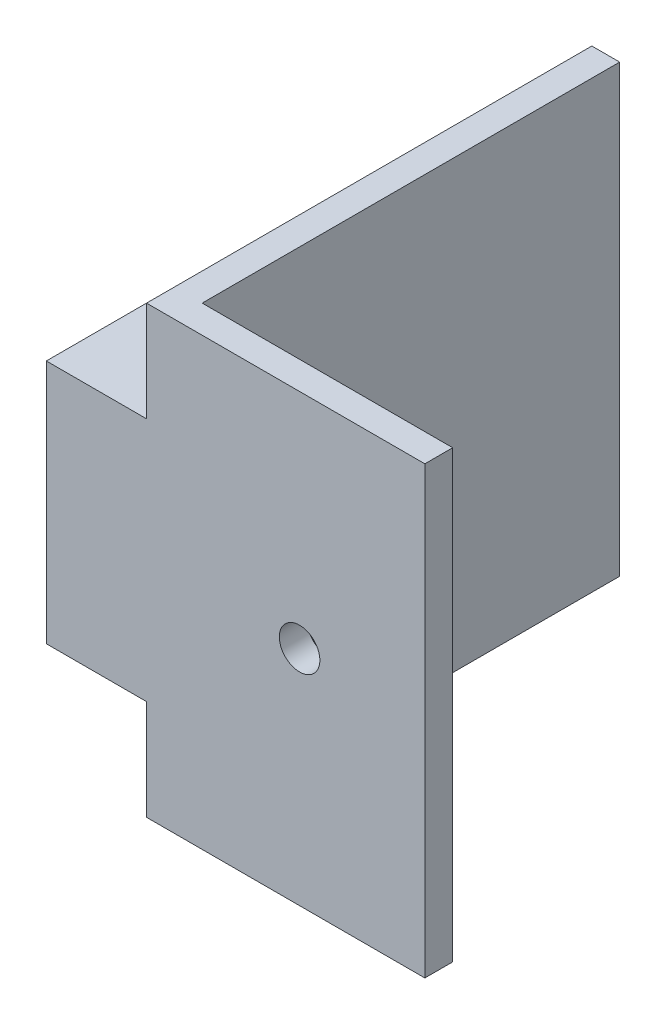
from build123d import *

# Parameters (mm, degrees)
BOSS_EXTRUDE1_DEPTH    = 50.8
F_12_28_TAPPED_HOLE1_D = 4.6228
SKETCH6_W              = 50.8
SKETCH6_H              = 27.94
BOSS_EXTRUDE2_DEPTH    = 11.43


with BuildPart() as part:
    # Sketch2 → Boss-Extrude1 (new body)
    with BuildSketch(Plane(origin=(0, 0, 0), x_dir=(1, 0, 0), z_dir=(0, 1, 0))):
        Polygon((0, 0), (0, 50.8), (3.175, 50.8), (3.175, 3.175), (31.75, 3.175), (31.75, 0), align=None)
    extrude(amount=BOSS_EXTRUDE1_DEPTH)

    # #12-28 Tapped Hole1 (through all)
    with Locations(Plane(origin=(0, 0, -3.175), x_dir=(-1, 0, 0), z_dir=(0, 0, -1))):
        with Locations((-17.4625, 25.4)):
            Hole(F_12_28_TAPPED_HOLE1_D / 2)

    # Sketch6 → Boss-Extrude2 (add)
    with BuildSketch(Plane.ZY):
        with Locations((-25.4, 25.4)):
            Rectangle(SKETCH6_W, SKETCH6_H)
    extrude(amount=BOSS_EXTRUDE2_DEPTH)


solid = part.part
